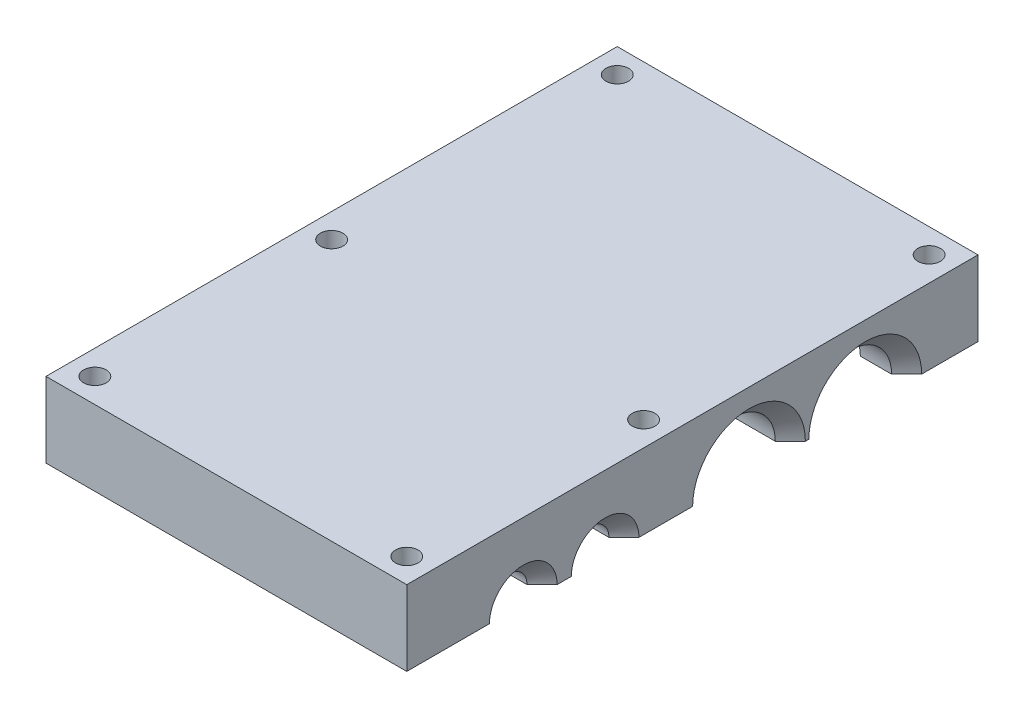
from build123d import *

# Parameters (mm, degrees)
SKETCH1_W                   = 48
SKETCH1_H                   = 76
BOSS_EXTRUDE1_DEPTH         = 10
SKETCH2_R                   = 5.5
SKETCH2_R_2                 = 2.5
CUT_EXTRUDE1_DEPTH          = 63.032249677
CUT_EXTRUDE2_DEPTH          = 40
FILLET1_R                   = 3.6
FILLET2_R                   = 2.5
M3_TAPPED_HOLE1_D           = 2.5
M3_TAPPED_HOLE1_CSINK_D     = 3.05
M3_TAPPED_HOLE1_CSINK_ANGLE = 90
CHAMFER1_SIZE               = 2
SKETCH6_R                   = 1.5
CUT_EXTRUDE3_DEPTH          = 10
BOSS_EXTRUDE2_DEPTH         = 6.8
CHAMFER2_SIZE               = 2
SKETCH8_W                   = 3
SKETCH8_H                   = 33.594295814
CUT_EXTRUDE4_DEPTH          = 5


with BuildPart() as part:
    # Sketch1 → Boss-Extrude1 (new body)
    with BuildSketch(Plane(origin=(0, 0, 0), x_dir=(1, 0, 0), z_dir=(0, 1, 0))):
        Rectangle(SKETCH1_W, SKETCH1_H)
    extrude(amount=BOSS_EXTRUDE1_DEPTH)

    # Sketch2 → Cut-Extrude1 (cut, through all)
    with BuildSketch(Plane.ZY.offset(24)):
        with Locations((-23, 10)):
            Circle(SKETCH2_R)
        with Locations((-7.531152857, 10)):
            Circle(SKETCH2_R)
        with Locations((11.608764346, 10)):
            Circle(SKETCH2_R_2)
        with Locations((22.5, 10)):
            Circle(SKETCH2_R_2)
    extrude(amount=-CUT_EXTRUDE1_DEPTH, mode=Mode.SUBTRACT)

    # Sketch3 → Cut-Extrude2 (cut)
    with BuildSketch(Plane.ZY.offset(24)):
        with BuildLine():
            Line((-30.575601228, 16.807330276), (-30.575601228, 2.210930276))
            Line((-30.575601228, 2.210930276), (-22.840601228, 2.210930276))
            ThreePointArc((-22.840601228, 2.210930276), (-19.946134653, 2.772905234), (-17.472254435, 4.377171194))
            ThreePointArc((-17.472254435, 4.377171194), (-15.105601228, 5.332165574), (-12.73894802, 4.377171194))
            ThreePointArc((-12.73894802, 4.377171194), (0.284776113, 8.838942121), (-10.941513582, 16.807330276))
            Line((-10.941513582, 16.807330276), (-30.575601228, 16.807330276))
        make_face()
        with BuildLine():
            Line((6.124741926, 18.195630094), (6.124741926, 4.592448506))
            Line((6.124741926, 4.592448506), (11.608764346, 4.592448506))
            ThreePointArc((11.608764346, 4.592448506), (13.597512463, 4.971432203), (15.307501103, 6.055261787))
            ThreePointArc((15.307501103, 6.055261787), (16.948477041, 6.705162469), (18.590697922, 6.058414065))
            ThreePointArc((18.590697922, 6.058414065), (26.266760255, 6.298858065), (26.068998857, 13.976138617))
            Line((26.068998857, 13.976138617), (6.124741926, 18.195630094))
        make_face()
    extrude(amount=-CUT_EXTRUDE2_DEPTH, mode=Mode.SUBTRACT)

    # Fillet1
    fillet1_edges = [part.edges().sort_by_distance(p)[0] for p in [
        (-4, 2.210930276, -30.575601228),
    ]]
    fillet(fillet1_edges, radius=FILLET1_R)

    # Fillet2
    fillet2_edges = [part.edges().sort_by_distance(p)[0] for p in [
        (-4, 4.592448506, 6.124741926),
    ]]
    fillet(fillet2_edges, radius=FILLET2_R)

    # M3 Tapped Hole1 (through all)
    with Locations(Plane(origin=(0, 10, 0), x_dir=(1, 0, 0), z_dir=(0, 1, 0))):
        with Locations((-20.75, 34.75), (20.75, 34.75), (20.75, -3.244475858), (-20.75, -3.244475858), (-20.75, -34.75), (20.75, -34.75)):
            CounterSinkHole(M3_TAPPED_HOLE1_D / 2, M3_TAPPED_HOLE1_CSINK_D / 2, counter_sink_angle=M3_TAPPED_HOLE1_CSINK_ANGLE)

    # Chamfer1
    chamfer1_edges = [part.edges().sort_by_distance(p)[0] for p in [
        (-24, 2.210930276, -24.908101228),
        (-24, 3.265345864, -29.52118564),
        (-24, 4.592448506, 10.116753136),
        (-24, 5.324681553, 6.856974973),
        (-24, 7.905465138, -30.575601228),
        (-24, 2.772905234, -19.946134653),
        (-24, 5.332165574, -15.105601228),
        (-24, 2.837756402, -4.320340718),
        (-24, 8.546224253, 6.124741926),
        (-24, 4.971432203, 13.597512463),
        (-24, 6.705162469, 16.948477041),
        (-24, 5.035673535, 24.459770758),
    ]]
    chamfer(chamfer1_edges, length=CHAMFER1_SIZE)


with BuildPart() as body_2:
    # Mirror1: mirrored copy
    add(part.part.mirror(Plane(origin=(0, 10, 0), x_dir=(0, 0, 1), z_dir=(0, -1, 0))))

    # Sketch6 → Cut-Extrude3 (cut)
    with BuildSketch(Plane(origin=(0, 20, 0), x_dir=(1, 0, 0), z_dir=(0, 1, 0))):
        with Locations(Location((20.75, 34.75, 0), (0, 0, 270))):
            Circle(SKETCH6_R)
        with Locations(Location((-20.75, 34.75, 0), (0, 0, 270))):
            Circle(SKETCH6_R)
        with Locations(Location((-20.75, -3.244475858, 0), (0, 0, 270))):
            Circle(SKETCH6_R)
        with Locations(Location((20.75, -3.244475858, 0), (0, 0, 270))):
            Circle(SKETCH6_R)
        with Locations(Location((20.75, -34.75, 0), (0, 0, 270))):
            Circle(SKETCH6_R)
        with Locations(Location((-20.75, -34.75, 0), (0, 0, 270))):
            Circle(SKETCH6_R)
    extrude(amount=-CUT_EXTRUDE3_DEPTH, mode=Mode.SUBTRACT)

    # Sketch7 → Boss-Extrude2 (add)
    with BuildSketch(Plane.ZY.offset(-16)):
        with BuildLine():
            Line((6.124741926, 12.907551494), (6.124741926, 10))
            Line((6.124741926, 10), (9.108764346, 10))
            ThreePointArc((9.108764346, 10), (11.608764346, 12.5), (14.108764346, 10))
            Line((14.108764346, 10), (20, 10))
            ThreePointArc((20, 10), (22.5, 12.5), (25, 10))
            Line((25, 10), (27.753321561, 10))
            ThreePointArc((27.753321561, 10), (24.459770758, 14.964326465), (18.590697922, 13.941585935))
            ThreePointArc((18.590697922, 13.941585935), (16.948477041, 13.294837531), (15.307501103, 13.944738213))
            ThreePointArc((15.307501103, 13.944738213), (13.597512463, 15.028567797), (11.608764346, 15.407551494))
            Line((11.608764346, 15.407551494), (8.624741926, 15.407551494))
            ThreePointArc((8.624741926, 15.407551494), (6.856974973, 14.675318447), (6.124741926, 12.907551494))
        make_face()
    extrude(amount=BOSS_EXTRUDE2_DEPTH)

    # Chamfer2
    chamfer2_edges = [body_2.edges().sort_by_distance(p)[0] for p in [
        (24, 15.5, -23),
        (24, 15.5, -7.531152857),
        (24, 12.5, 11.608764346),
        (24, 12.5, 22.5),
    ]]
    chamfer(chamfer2_edges, length=CHAMFER2_SIZE)

    # Sketch8 → Cut-Extrude4 (cut)
    with BuildSketch(Plane.XZ.offset(-10)):
        with Locations((16.34371358, -39.350695858)):
            Rectangle(SKETCH8_W, SKETCH8_H)
    extrude(amount=-CUT_EXTRUDE4_DEPTH, mode=Mode.SUBTRACT)


solid = body_2.part
